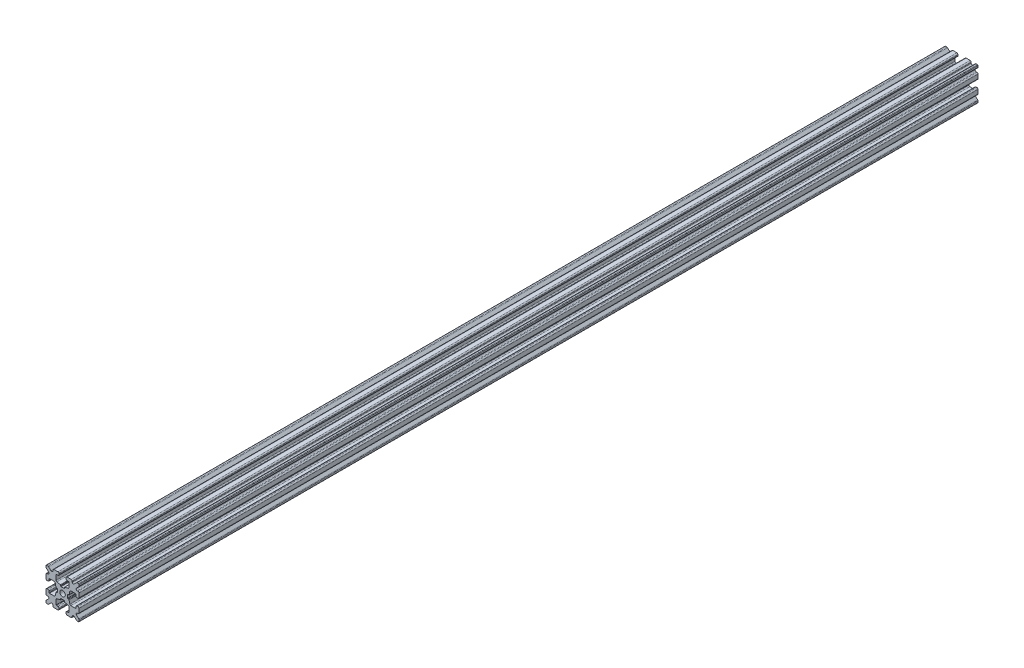
from build123d import *

# Parameters (mm, degrees)
SKETCH1_W           = 15
SKETCH1_H           = 15
SKETCH1_R           = 1.25
BOSS_EXTRUDE1_DEPTH = 204
FILLET1_R           = 0.25
CUT_EXTRUDE1_DEPTH  = 409.137844361
CUT_EXTRUDE3_DEPTH  = 409.137844361
FILLET3_R           = 0.5
FILLET4_R           = 0.5
FILLET5_R           = 3
FILLET6_R           = 0.2
CUT_EXTRUDE4_DEPTH  = 409.137844361
FILLET8_R           = 0.5
SKETCH6_W           = 5.1529354
SKETCH6_H           = 1.651
SKETCH6_W_2         = 1.651
SKETCH6_H_2         = 5.1529354
CUT_EXTRUDE5_DEPTH  = 409.137844361
FILLET10_R          = 0.2


with BuildPart() as part:
    # Sketch1 → Boss-Extrude1 (new, symmetric)
    with BuildSketch(Plane.XY):
        Rectangle(SKETCH1_W, SKETCH1_H)
        Circle(SKETCH1_R, mode=Mode.SUBTRACT)
    extrude(amount=BOSS_EXTRUDE1_DEPTH, both=True)

    # Fillet1
    fillet1_edges = [part.edges().sort_by_distance(p)[0] for p in [
        (7.5, -7.5, 0),
        (-7.5, -7.5, 0),
        (-7.5, 7.5, 0),
        (7.5, 7.5, 0),
    ]]
    fillet(fillet1_edges, radius=FILLET1_R)

    # Sketch2 → Cut-Extrude1 (cut, through all)
    with BuildSketch(Plane.XY.offset(204)):
        Polygon((-7.5, 1.6), (-6.1, 1.6), (-6.1, 2.9), (-3.4, 2.9), (-3.4, -2.9), (-6.1, -2.9), (-6.1, -1.6), (-7.5, -1.6), align=None)
        Polygon((2.9, 6.1), (1.6, 6.1), (1.6, 7.5), (-1.6, 7.5), (-1.6, 6.1), (-2.9, 6.1), (-2.9, 3.4), (2.9, 3.4), align=None)
        Polygon((-1.6, -7.5), (-1.6, -6.1), (-2.9, -6.1), (-2.9, -3.4), (2.9, -3.4), (2.9, -6.1), (1.6, -6.1), (1.6, -7.5), align=None)
        Polygon((6.1, -2.9), (6.1, -1.6), (7.5, -1.6), (7.5, 1.6), (6.1, 1.6), (6.1, 2.9), (3.4, 2.9), (3.4, -2.9), align=None)
    extrude(amount=-CUT_EXTRUDE1_DEPTH, mode=Mode.SUBTRACT)

    # Sketch4 → Cut-Extrude3 (cut, through all)
    with BuildSketch(Plane.XY.offset(204)):
        Polygon((-3.4, 2.9), (-2.75, 0), (-3.4, -2.9), align=None)
        Polygon((-2.9, 3.4), (0, 2.75), (2.9, 3.4), align=None)
        Polygon((3.4, 2.9), (2.75, 0), (3.4, -2.9), align=None)
        Polygon((-2.9, -3.4), (0, -2.75), (2.9, -3.4), align=None)
    extrude(amount=-CUT_EXTRUDE3_DEPTH, mode=Mode.SUBTRACT)

    # Fillet3
    fillet3_edges = [part.edges().sort_by_distance(p)[0] for p in [
        (1.6, -7.5, 0),
        (-1.6, -7.5, 0),
        (-1.6, -6.1, 0),
        (1.6, -6.1, 0),
        (6.1, 1.6, 0),
        (7.5, 1.6, 0),
        (7.5, -1.6, 0),
        (6.1, -1.6, 0),
        (-7.5, -1.6, 0),
        (-7.5, 1.6, 0),
        (-6.1, 1.6, 0),
        (-6.1, -1.6, 0),
        (-1.6, 6.1, 0),
        (-1.6, 7.5, 0),
        (1.6, 7.5, 0),
        (1.6, 6.1, 0),
    ]]
    fillet(fillet3_edges, radius=FILLET3_R)

    # Fillet4
    fillet4_edges = [part.edges().sort_by_distance(p)[0] for p in [
        (-2.9, -3.4, 0),
        (2.9, -3.4, 0),
        (3.4, -2.9, 0),
        (3.4, 2.9, 0),
        (-3.4, 2.9, 0),
        (-3.4, -2.9, 0),
        (2.9, 3.4, 0),
        (-2.9, 3.4, 0),
    ]]
    fillet(fillet4_edges, radius=FILLET4_R)

    # Fillet5
    fillet5_edges = [part.edges().sort_by_distance(p)[0] for p in [
        (-2.75, 0, 0),
        (0, 2.75, 0),
        (2.75, 0, 0),
        (0, -2.75, 0),
    ]]
    fillet(fillet5_edges, radius=FILLET5_R)

    # Fillet6
    fillet6_edges = [part.edges().sort_by_distance(p)[0] for p in [
        (-2.9, -6.1, 0),
        (2.9, -6.1, 0),
        (6.1, -2.9, 0),
        (6.1, 2.9, 0),
        (-6.1, 2.9, 0),
        (-6.1, -2.9, 0),
        (2.9, 6.1, 0),
        (-2.9, 6.1, 0),
    ]]
    fillet(fillet6_edges, radius=FILLET6_R)

    # Sketch5 → Cut-Extrude4 (cut, through all)
    with BuildSketch(Plane.XY.offset(204)):
        Polygon((-7.5, 6.439339828), (-5.460660172, 4.4), (-7.5, 4.4), align=None)
        Polygon((-6.439339828, 7.5), (-4.4, 5.460660172), (-4.4, 7.5), align=None)
        Polygon((4.4, 7.5), (6.439339828, 7.5), (4.4, 5.460660172), align=None)
        Polygon((7.5, 6.439339828), (7.5, 4.4), (5.460660172, 4.4), align=None)
        Polygon((7.5, -6.439339828), (5.460660172, -4.4), (7.5, -4.4), align=None)
        Polygon((6.439339828, -7.5), (4.4, -5.460660172), (4.4, -7.5), align=None)
        Polygon((-4.4, -7.5), (-6.439339828, -7.5), (-4.4, -5.460660172), align=None)
        Polygon((-7.5, -6.439339828), (-7.5, -4.4), (-5.460660172, -4.4), align=None)
    extrude(amount=-CUT_EXTRUDE4_DEPTH, mode=Mode.SUBTRACT)

    # Fillet8
    fillet8_edges = [part.edges().sort_by_distance(p)[0] for p in [
        (-7.5, 4.4, 0),
        (-7.5, 6.439339828, 0),
        (-5.460660172, 4.4, 0),
        (7.5, -4.4, 0),
        (7.5, -6.439339828, 0),
        (5.460660172, -4.4, 0),
        (5.460660172, 4.4, 0),
        (7.5, 6.439339828, 0),
        (7.5, 4.4, 0),
        (-4.4, 7.5, 0),
        (-4.4, 5.460660172, 0),
        (-6.439339828, 7.5, 0),
        (-5.460660172, -4.4, 0),
        (-7.5, -6.439339828, 0),
        (-7.5, -4.4, 0),
        (4.4, 5.460660172, 0),
        (4.4, 7.5, 0),
        (6.439339828, 7.5, 0),
        (6.439339828, -7.5, 0),
        (4.4, -7.5, 0),
        (4.4, -5.460660172, 0),
        (-6.439339828, -7.5, 0),
        (-4.4, -5.460660172, 0),
        (-4.4, -7.5, 0),
    ]]
    fillet(fillet8_edges, radius=FILLET8_R)

    # Sketch6 → Cut-Extrude5 (cut, through all)
    with BuildSketch(Plane.XY.offset(204)):
        with Locations((4.9235323, 0)):
            Rectangle(SKETCH6_W, SKETCH6_H)
        with Locations((0, -4.9235323)):
            Rectangle(SKETCH6_W_2, SKETCH6_H_2)
        with Locations((-4.9235323, 0)):
            Rectangle(SKETCH6_W, SKETCH6_H)
        with Locations((0, 4.9235323)):
            Rectangle(SKETCH6_W_2, SKETCH6_H_2)
    extrude(amount=-CUT_EXTRUDE5_DEPTH, mode=Mode.SUBTRACT)

    # Fillet10
    fillet10_edges = [part.edges().sort_by_distance(p)[0] for p in [
        (0.8255, -2.935025862, 0),
        (-0.8255, -2.935025862, 0),
        (0.8255, -2.3470646, 0),
        (-0.8255, -2.3470646, 0),
        (2.935025862, 0.8255, 0),
        (2.935025862, -0.8255, 0),
        (2.3470646, 0.8255, 0),
        (2.3470646, -0.8255, 0),
        (-2.935025862, -0.8255, 0),
        (-2.935025862, 0.8255, 0),
        (-2.3470646, -0.8255, 0),
        (-2.3470646, 0.8255, 0),
        (-0.8255, 2.935025862, 0),
        (0.8255, 2.935025862, 0),
        (-0.8255, 2.3470646, 0),
        (0.8255, 2.3470646, 0),
    ]]
    fillet(fillet10_edges, radius=FILLET10_R)


solid = part.part
